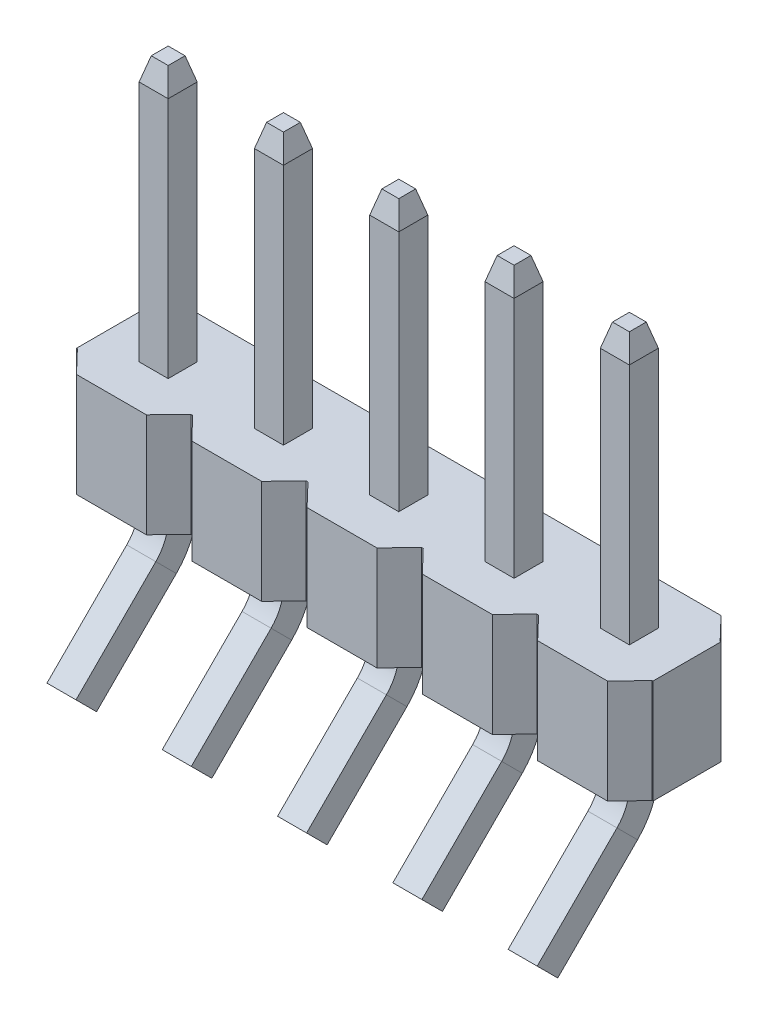
from build123d import *
from OCP.BRepFilletAPI import BRepFilletAPI_MakeChamfer

# Parameters (mm, degrees)
BOSS_EXTRUDE1_DEPTH         = 2.29
SKETCH3_W                   = 0.64
SKETCH3_H                   = 0.64
CHAMFER3_SIZE               = 0.5
CHAMFER3_SIZE2              = 0.133974596
LPATTERN1_COUNT             = 5
LPATTERN1_PITCH             = 2.54
CHAMFER3_OF_LPATTERN1_SIZE  = 0.5
CHAMFER3_OF_LPATTERN1_SIZE2 = 0.133974596


with BuildPart() as part:
    # Sketch1 → Boss-Extrude1 (new body)
    with BuildSketch(Plane(origin=(0, 0, 0), x_dir=(1, 0, 0), z_dir=(0, 1, 0))):
        Polygon((-0.77, 1.25), (0.77, 1.25), (1.25, 0.75), (1.27, 0.75), (1.27, -0.75), (1.25, -0.75), (0.77, -1.25), (-0.77, -1.25), (-1.25, -0.75), (-1.27, -0.75), (-1.27, 0.75), (-1.25, 0.75), align=None)
    boss_extrude1 = extrude(amount=BOSS_EXTRUDE1_DEPTH)

    # Sweep1: sweep along a path in Sketch2
    with BuildLine(Plane(origin=(0, 0, 0), x_dir=(0, 0, -1), z_dir=(1, 0, 0))) as sweep1_path:
        Line((0, 8.13), (0, -0.408142235))
        ThreePointArc((0, -0.408142235), (-0.095150584, -0.886496526), (-0.366116524, -1.292025712))
        Line((-0.366116524, -1.292025712), (-2.124090812, -3.05))
    # Sketch3 → Sweep1 (sweep)
    with BuildSketch(Plane(origin=(0, 8.13, 0), x_dir=(1, 0, 0), z_dir=(0, 1, 0))):
        Rectangle(SKETCH3_W, SKETCH3_H)
    sweep1 = sweep(path=sweep1_path.line)

    # Chamfer3: one chamfer whose edges measure the first distance from different faces: ONE call of the kernel's chamfer builder (chamfer() names one face for all edges)
    chamfer3_edges_1 = [part.edges().sort_by_distance(p)[0] for p in [
        (0.32, 8.13, 0),
    ]]
    chamfer3_side_1 = [part.faces().sort_by_distance(p)[0] for p in [
        (0.32, 5.21, 0),
    ]]
    chamfer3_edges_2 = [part.edges().sort_by_distance(p)[0] for p in [
        (0, 8.13, -0.32),
    ]]
    chamfer3_side_2 = [part.faces().sort_by_distance(p)[0] for p in [
        (0, 5.21, -0.32),
    ]]
    chamfer3_edges_3 = [part.edges().sort_by_distance(p)[0] for p in [
        (-0.32, 8.13, 0),
    ]]
    chamfer3_side_3 = [part.faces().sort_by_distance(p)[0] for p in [
        (-0.32, 5.21, 0),
    ]]
    chamfer3_edges_4 = [part.edges().sort_by_distance(p)[0] for p in [
        (0, 8.13, 0.32),
    ]]
    chamfer3_side_4 = [part.faces().sort_by_distance(p)[0] for p in [
        (0, 5.21, 0.32),
    ]]
    chamfer3 = BRepFilletAPI_MakeChamfer(part.part.solid().wrapped)
    for e in chamfer3_edges_1:
        chamfer3.Add(CHAMFER3_SIZE, CHAMFER3_SIZE2, e.wrapped, chamfer3_side_1[0].wrapped)  # the first distance lies on this face
    for e in chamfer3_edges_2:
        chamfer3.Add(CHAMFER3_SIZE, CHAMFER3_SIZE2, e.wrapped, chamfer3_side_2[0].wrapped)  # the first distance lies on this face
    for e in chamfer3_edges_3:
        chamfer3.Add(CHAMFER3_SIZE, CHAMFER3_SIZE2, e.wrapped, chamfer3_side_3[0].wrapped)  # the first distance lies on this face
    for e in chamfer3_edges_4:
        chamfer3.Add(CHAMFER3_SIZE, CHAMFER3_SIZE2, e.wrapped, chamfer3_side_4[0].wrapped)  # the first distance lies on this face
    add(Compound.cast(chamfer3.Shape()), mode=Mode.REPLACE)

    # LPattern1: Boss-Extrude1, Sweep1 ×5
    with Locations(*[(i * LPATTERN1_PITCH, 0, 0) for i in range(1, LPATTERN1_COUNT)]):
        add(boss_extrude1)
        add(sweep1)

    # Chamfer3 of LPattern1: one chamfer whose edges measure the first distance from different faces: ONE call of the kernel's chamfer builder (chamfer() names one face for all edges)
    chamfer3_of_lpattern1_edges_1 = [part.edges().sort_by_distance(p)[0] for p in [
        (2.86, 8.13, 0),
    ]]
    chamfer3_of_lpattern1_side_1 = [part.faces().sort_by_distance(p)[0] for p in [
        (2.86, 5.21, 0),
    ]]
    chamfer3_of_lpattern1_edges_2 = [part.edges().sort_by_distance(p)[0] for p in [
        (2.54, 8.13, -0.32),
    ]]
    chamfer3_of_lpattern1_side_2 = [part.faces().sort_by_distance(p)[0] for p in [
        (2.54, 5.21, -0.32),
    ]]
    chamfer3_of_lpattern1_edges_3 = [part.edges().sort_by_distance(p)[0] for p in [
        (2.22, 8.13, 0),
    ]]
    chamfer3_of_lpattern1_side_3 = [part.faces().sort_by_distance(p)[0] for p in [
        (2.22, 5.21, 0),
    ]]
    chamfer3_of_lpattern1_edges_4 = [part.edges().sort_by_distance(p)[0] for p in [
        (2.54, 8.13, 0.32),
    ]]
    chamfer3_of_lpattern1_side_4 = [part.faces().sort_by_distance(p)[0] for p in [
        (2.54, 5.21, 0.32),
    ]]
    chamfer3_of_lpattern1_edges_5 = [part.edges().sort_by_distance(p)[0] for p in [
        (5.4, 8.13, 0),
    ]]
    chamfer3_of_lpattern1_side_5 = [part.faces().sort_by_distance(p)[0] for p in [
        (5.4, 5.21, 0),
    ]]
    chamfer3_of_lpattern1_edges_6 = [part.edges().sort_by_distance(p)[0] for p in [
        (5.08, 8.13, -0.32),
    ]]
    chamfer3_of_lpattern1_side_6 = [part.faces().sort_by_distance(p)[0] for p in [
        (5.08, 5.21, -0.32),
    ]]
    chamfer3_of_lpattern1_edges_7 = [part.edges().sort_by_distance(p)[0] for p in [
        (4.76, 8.13, 0),
    ]]
    chamfer3_of_lpattern1_side_7 = [part.faces().sort_by_distance(p)[0] for p in [
        (4.76, 5.21, 0),
    ]]
    chamfer3_of_lpattern1_edges_8 = [part.edges().sort_by_distance(p)[0] for p in [
        (5.08, 8.13, 0.32),
    ]]
    chamfer3_of_lpattern1_side_8 = [part.faces().sort_by_distance(p)[0] for p in [
        (5.08, 5.21, 0.32),
    ]]
    chamfer3_of_lpattern1_edges_9 = [part.edges().sort_by_distance(p)[0] for p in [
        (7.94, 8.13, 0),
    ]]
    chamfer3_of_lpattern1_side_9 = [part.faces().sort_by_distance(p)[0] for p in [
        (7.94, 5.21, 0),
    ]]
    chamfer3_of_lpattern1_edges_10 = [part.edges().sort_by_distance(p)[0] for p in [
        (7.62, 8.13, -0.32),
    ]]
    chamfer3_of_lpattern1_side_10 = [part.faces().sort_by_distance(p)[0] for p in [
        (7.62, 5.21, -0.32),
    ]]
    chamfer3_of_lpattern1_edges_11 = [part.edges().sort_by_distance(p)[0] for p in [
        (7.3, 8.13, 0),
    ]]
    chamfer3_of_lpattern1_side_11 = [part.faces().sort_by_distance(p)[0] for p in [
        (7.3, 5.21, 0),
    ]]
    chamfer3_of_lpattern1_edges_12 = [part.edges().sort_by_distance(p)[0] for p in [
        (7.62, 8.13, 0.32),
    ]]
    chamfer3_of_lpattern1_side_12 = [part.faces().sort_by_distance(p)[0] for p in [
        (7.62, 5.21, 0.32),
    ]]
    chamfer3_of_lpattern1_edges_13 = [part.edges().sort_by_distance(p)[0] for p in [
        (10.48, 8.13, 0),
    ]]
    chamfer3_of_lpattern1_side_13 = [part.faces().sort_by_distance(p)[0] for p in [
        (10.48, 5.21, 0),
    ]]
    chamfer3_of_lpattern1_edges_14 = [part.edges().sort_by_distance(p)[0] for p in [
        (10.16, 8.13, -0.32),
    ]]
    chamfer3_of_lpattern1_side_14 = [part.faces().sort_by_distance(p)[0] for p in [
        (10.16, 5.21, -0.32),
    ]]
    chamfer3_of_lpattern1_edges_15 = [part.edges().sort_by_distance(p)[0] for p in [
        (9.84, 8.13, 0),
    ]]
    chamfer3_of_lpattern1_side_15 = [part.faces().sort_by_distance(p)[0] for p in [
        (9.84, 5.21, 0),
    ]]
    chamfer3_of_lpattern1_edges_16 = [part.edges().sort_by_distance(p)[0] for p in [
        (10.16, 8.13, 0.32),
    ]]
    chamfer3_of_lpattern1_side_16 = [part.faces().sort_by_distance(p)[0] for p in [
        (10.16, 5.21, 0.32),
    ]]
    chamfer3_of_lpattern1 = BRepFilletAPI_MakeChamfer(part.part.solid().wrapped)
    for e in chamfer3_of_lpattern1_edges_1:
        chamfer3_of_lpattern1.Add(CHAMFER3_OF_LPATTERN1_SIZE, CHAMFER3_OF_LPATTERN1_SIZE2, e.wrapped, chamfer3_of_lpattern1_side_1[0].wrapped)  # the first distance lies on this face
    for e in chamfer3_of_lpattern1_edges_2:
        chamfer3_of_lpattern1.Add(CHAMFER3_OF_LPATTERN1_SIZE, CHAMFER3_OF_LPATTERN1_SIZE2, e.wrapped, chamfer3_of_lpattern1_side_2[0].wrapped)  # the first distance lies on this face
    for e in chamfer3_of_lpattern1_edges_3:
        chamfer3_of_lpattern1.Add(CHAMFER3_OF_LPATTERN1_SIZE, CHAMFER3_OF_LPATTERN1_SIZE2, e.wrapped, chamfer3_of_lpattern1_side_3[0].wrapped)  # the first distance lies on this face
    for e in chamfer3_of_lpattern1_edges_4:
        chamfer3_of_lpattern1.Add(CHAMFER3_OF_LPATTERN1_SIZE, CHAMFER3_OF_LPATTERN1_SIZE2, e.wrapped, chamfer3_of_lpattern1_side_4[0].wrapped)  # the first distance lies on this face
    for e in chamfer3_of_lpattern1_edges_5:
        chamfer3_of_lpattern1.Add(CHAMFER3_OF_LPATTERN1_SIZE, CHAMFER3_OF_LPATTERN1_SIZE2, e.wrapped, chamfer3_of_lpattern1_side_5[0].wrapped)  # the first distance lies on this face
    for e in chamfer3_of_lpattern1_edges_6:
        chamfer3_of_lpattern1.Add(CHAMFER3_OF_LPATTERN1_SIZE, CHAMFER3_OF_LPATTERN1_SIZE2, e.wrapped, chamfer3_of_lpattern1_side_6[0].wrapped)  # the first distance lies on this face
    for e in chamfer3_of_lpattern1_edges_7:
        chamfer3_of_lpattern1.Add(CHAMFER3_OF_LPATTERN1_SIZE, CHAMFER3_OF_LPATTERN1_SIZE2, e.wrapped, chamfer3_of_lpattern1_side_7[0].wrapped)  # the first distance lies on this face
    for e in chamfer3_of_lpattern1_edges_8:
        chamfer3_of_lpattern1.Add(CHAMFER3_OF_LPATTERN1_SIZE, CHAMFER3_OF_LPATTERN1_SIZE2, e.wrapped, chamfer3_of_lpattern1_side_8[0].wrapped)  # the first distance lies on this face
    for e in chamfer3_of_lpattern1_edges_9:
        chamfer3_of_lpattern1.Add(CHAMFER3_OF_LPATTERN1_SIZE, CHAMFER3_OF_LPATTERN1_SIZE2, e.wrapped, chamfer3_of_lpattern1_side_9[0].wrapped)  # the first distance lies on this face
    for e in chamfer3_of_lpattern1_edges_10:
        chamfer3_of_lpattern1.Add(CHAMFER3_OF_LPATTERN1_SIZE, CHAMFER3_OF_LPATTERN1_SIZE2, e.wrapped, chamfer3_of_lpattern1_side_10[0].wrapped)  # the first distance lies on this face
    for e in chamfer3_of_lpattern1_edges_11:
        chamfer3_of_lpattern1.Add(CHAMFER3_OF_LPATTERN1_SIZE, CHAMFER3_OF_LPATTERN1_SIZE2, e.wrapped, chamfer3_of_lpattern1_side_11[0].wrapped)  # the first distance lies on this face
    for e in chamfer3_of_lpattern1_edges_12:
        chamfer3_of_lpattern1.Add(CHAMFER3_OF_LPATTERN1_SIZE, CHAMFER3_OF_LPATTERN1_SIZE2, e.wrapped, chamfer3_of_lpattern1_side_12[0].wrapped)  # the first distance lies on this face
    for e in chamfer3_of_lpattern1_edges_13:
        chamfer3_of_lpattern1.Add(CHAMFER3_OF_LPATTERN1_SIZE, CHAMFER3_OF_LPATTERN1_SIZE2, e.wrapped, chamfer3_of_lpattern1_side_13[0].wrapped)  # the first distance lies on this face
    for e in chamfer3_of_lpattern1_edges_14:
        chamfer3_of_lpattern1.Add(CHAMFER3_OF_LPATTERN1_SIZE, CHAMFER3_OF_LPATTERN1_SIZE2, e.wrapped, chamfer3_of_lpattern1_side_14[0].wrapped)  # the first distance lies on this face
    for e in chamfer3_of_lpattern1_edges_15:
        chamfer3_of_lpattern1.Add(CHAMFER3_OF_LPATTERN1_SIZE, CHAMFER3_OF_LPATTERN1_SIZE2, e.wrapped, chamfer3_of_lpattern1_side_15[0].wrapped)  # the first distance lies on this face
    for e in chamfer3_of_lpattern1_edges_16:
        chamfer3_of_lpattern1.Add(CHAMFER3_OF_LPATTERN1_SIZE, CHAMFER3_OF_LPATTERN1_SIZE2, e.wrapped, chamfer3_of_lpattern1_side_16[0].wrapped)  # the first distance lies on this face
    add(Compound.cast(chamfer3_of_lpattern1.Shape()), mode=Mode.REPLACE)


solid = part.part
